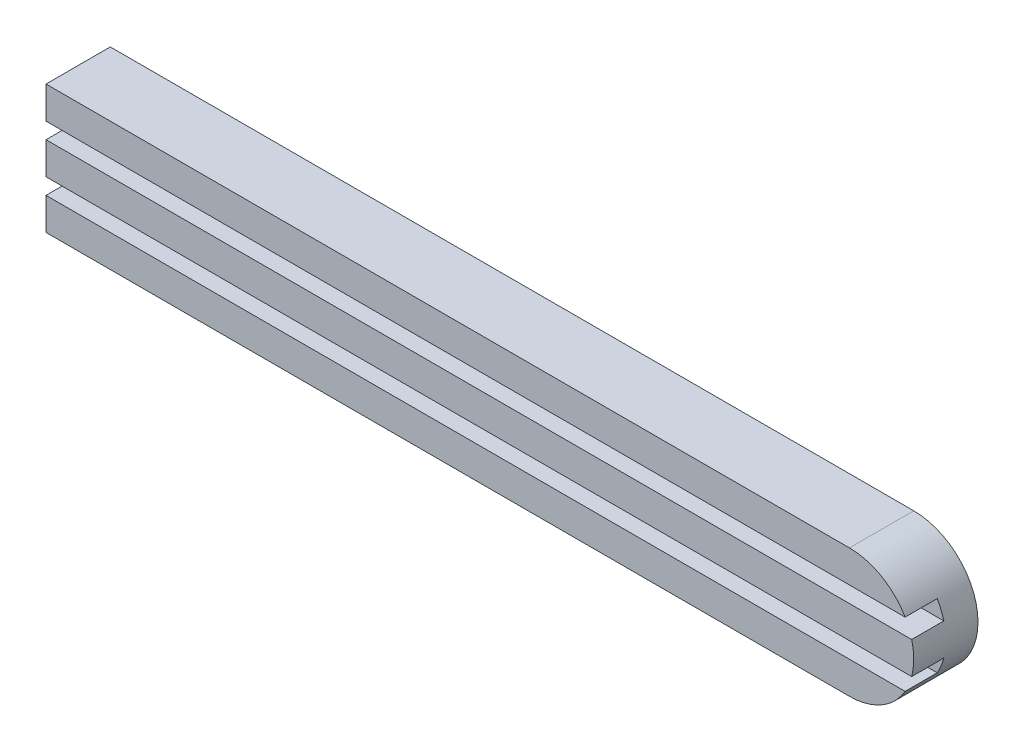
from build123d import *

# Parameters (mm, degrees)
BOSS_EXTRUDE1_DEPTH = 10
BOSS_EXTRUDE2_DEPTH = 10


with BuildPart() as part:
    # Sketch2 → Boss-Extrude1 (new body)
    with BuildSketch(Plane.XY):
        with BuildLine():
            Line((0, 0), (250, 0))
            ThreePointArc((250, 0), (270, 20), (250, 40))
            Line((250, 40), (0, 40))
            Line((0, 40), (0, 0))
        make_face()
    extrude(amount=BOSS_EXTRUDE1_DEPTH)

    # Sketch3 → Boss-Extrude2 (add)
    with BuildSketch(Plane.XY.offset(10)):
        with BuildLine():
            ThreePointArc((250, 0), (260, 2.679491924), (267.320508076, 10))
            Line((267.320508076, 10), (115.043886481, 10))
            Line((115.043886481, 10), (0, 10))
            Line((0, 10), (0, 0))
            Line((0, 0), (250, 0))
        make_face()
        with BuildLine():
            ThreePointArc((269.364916731, 15), (270, 20), (269.364916731, 25))
            Line((269.364916731, 25), (0, 25))
            Line((0, 25), (0, 15))
            Line((0, 15), (269.364916731, 15))
        make_face()
        with BuildLine():
            ThreePointArc((267.320508076, 30), (260, 37.320508076), (250, 40))
            Line((250, 40), (0, 40))
            Line((0, 40), (0, 30))
            Line((0, 30), (267.320508076, 30))
        make_face()
    extrude(amount=BOSS_EXTRUDE2_DEPTH)


solid = part.part
